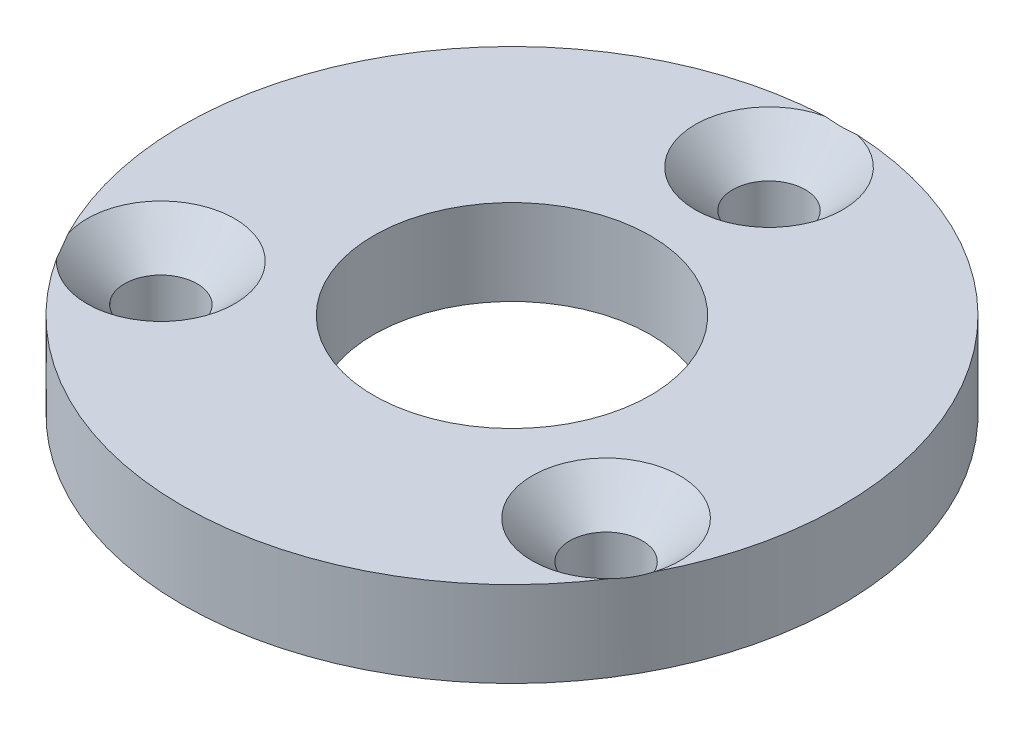
from build123d import *

# Parameters (mm, degrees)
SKETCH1_R                     = 25
SKETCH1_R_2                   = 10.5
BOSS_EXTRUDE1_DEPTH           = 6.5
CSK_FOR_M5_SFHCS1_D           = 5.5
CSK_FOR_M5_SFHCS1_CSINK_D     = 11.2
CSK_FOR_M5_SFHCS1_CSINK_ANGLE = 90
CIRPATTERN1_COUNT             = 3


with BuildPart() as part:
    # Sketch1 → Boss-Extrude1 (new body)
    with BuildSketch(Plane(origin=(0, 0, 0), x_dir=(1, 0, 0), z_dir=(0, 1, 0))):
        with Locations(Location((0, 0, 0), (0, 0, 90))):
            Circle(SKETCH1_R)
        with Locations(Location((0, 0, 0), (0, 0, 90))):
            Circle(SKETCH1_R_2, mode=Mode.SUBTRACT)
    extrude(amount=BOSS_EXTRUDE1_DEPTH)

    # CSK for M5 SFHCS1 (through all)
    with Locations(Plane(origin=(0, 6.5, 0), x_dir=(1, 0, 0), z_dir=(0, 1, 0))):
        with Locations((0, 19.5)):
            csk_for_m5_sfhcs1 = CounterSinkHole(CSK_FOR_M5_SFHCS1_D / 2, CSK_FOR_M5_SFHCS1_CSINK_D / 2, counter_sink_angle=CSK_FOR_M5_SFHCS1_CSINK_ANGLE)

    # CirPattern1: CSK for M5 SFHCS1 ×3 about axis
    cirpattern1_axis = Axis((0, 0, 0), (0, 1, 0))
    for i in range(1, CIRPATTERN1_COUNT):
        add(csk_for_m5_sfhcs1.rotate(cirpattern1_axis, i * 360 / CIRPATTERN1_COUNT), mode=Mode.SUBTRACT)


solid = part.part
